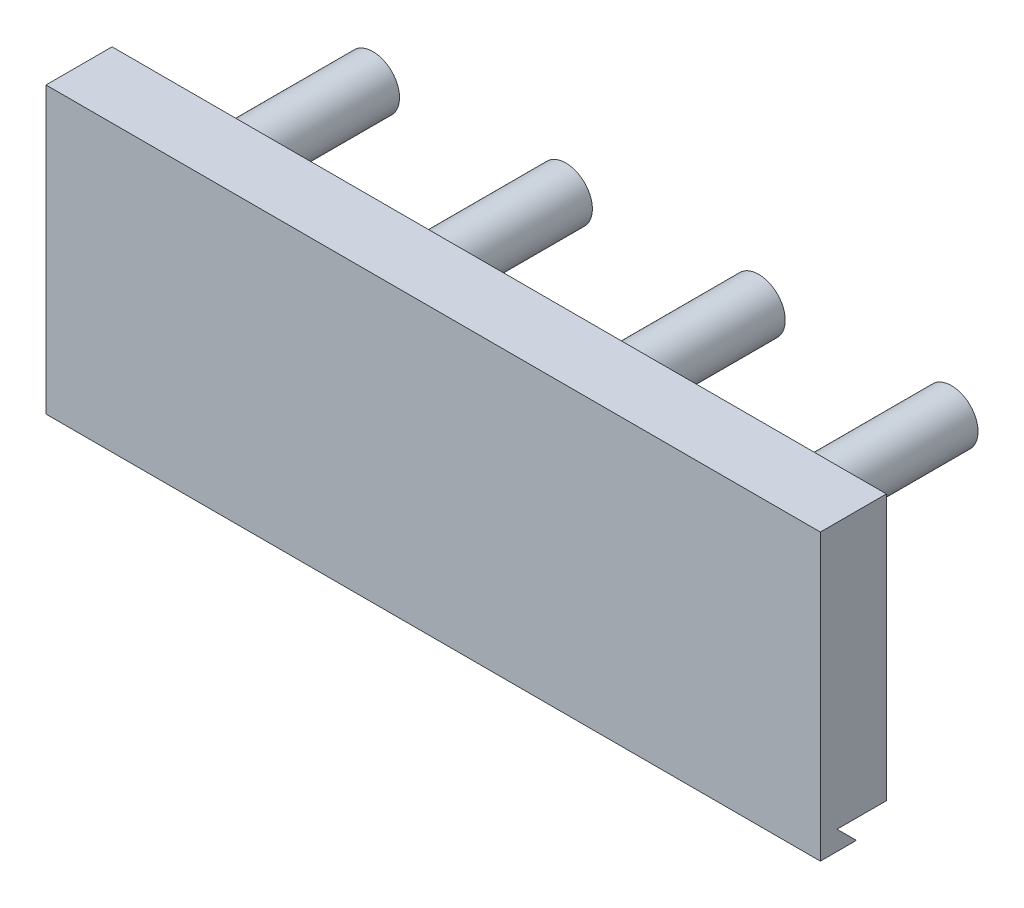
from build123d import *

# Parameters (mm, degrees)
SKETCH1_W           = 102
SKETCH1_H           = 35
BOSS_EXTRUDE1_DEPTH = 8.7
BOSS_EXTRUDE2_DEPTH = 102
SKETCH5_R           = 3.5
BOSS_EXTRUDE3_DEPTH = 20


with BuildPart() as part:
    # Sketch1 → Boss-Extrude1 (new body)
    with BuildSketch(Plane.XY):
        Rectangle(SKETCH1_W, SKETCH1_H)
    extrude(amount=BOSS_EXTRUDE1_DEPTH)

    # Sketch4 → Boss-Extrude2 (add)
    with BuildSketch(Plane.ZY.offset(51)):
        Polygon((6.5, -17.5), (8.7, -17.5), (8.7, -20.045584412), (3.954415588, -20.045584412), align=None)
    extrude(amount=-BOSS_EXTRUDE2_DEPTH)

    # Sketch5 → Boss-Extrude3 (add)
    with BuildSketch(Plane(origin=(0, 0, 0), x_dir=(-1, 0, 0), z_dir=(0, 0, -1))):
        with Locations((-39.57, 10.64)):
            Circle(SKETCH5_R)
        with Locations((-14.17, 10.64)):
            Circle(SKETCH5_R)
        with Locations((11.23, 10.64)):
            Circle(SKETCH5_R)
        with Locations((36.63, 10.64)):
            Circle(SKETCH5_R)
    extrude(amount=BOSS_EXTRUDE3_DEPTH)


solid = part.part
